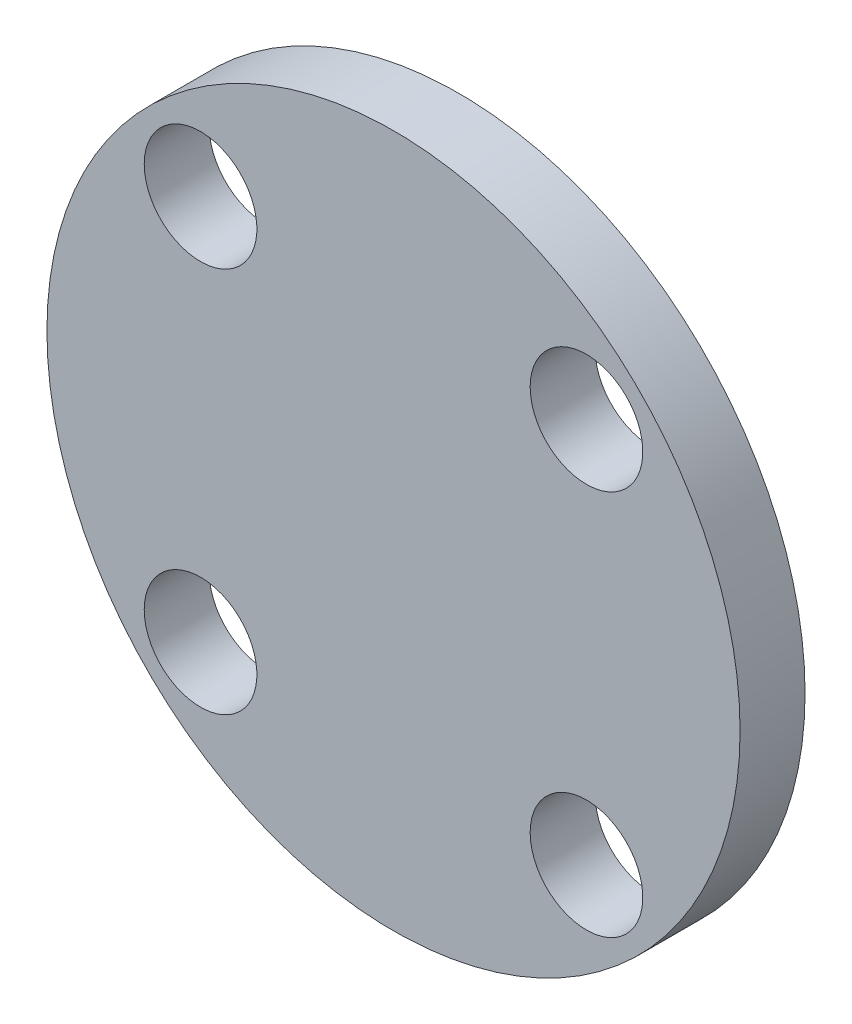
from build123d import *

# Parameters (mm, degrees)
SKETCH2_R           = 50.8
SKETCH2_R_2         = 8.255
BOSS_EXTRUDE2_DEPTH = 9.525


with BuildPart() as part:
    # Sketch2 → Boss-Extrude2 (new body)
    with BuildSketch(Plane.XY):
        with Locations(Location((0, 0, 0), (0, 0, 180))):
            Circle(SKETCH2_R)
        with Locations(Location((-28.284214679, 28.284214679, 0), (0, 0, 180))):
            Circle(SKETCH2_R_2, mode=Mode.SUBTRACT)
        with Locations(Location((28.284214679, 28.284214679, 0), (0, 0, 180))):
            Circle(SKETCH2_R_2, mode=Mode.SUBTRACT)
        with Locations(Location((28.284214679, -28.284214679, 0), (0, 0, 180))):
            Circle(SKETCH2_R_2, mode=Mode.SUBTRACT)
        with Locations(Location((-28.284214679, -28.284214679, 0), (0, 0, 180))):
            Circle(SKETCH2_R_2, mode=Mode.SUBTRACT)
    extrude(amount=BOSS_EXTRUDE2_DEPTH)


solid = part.part
